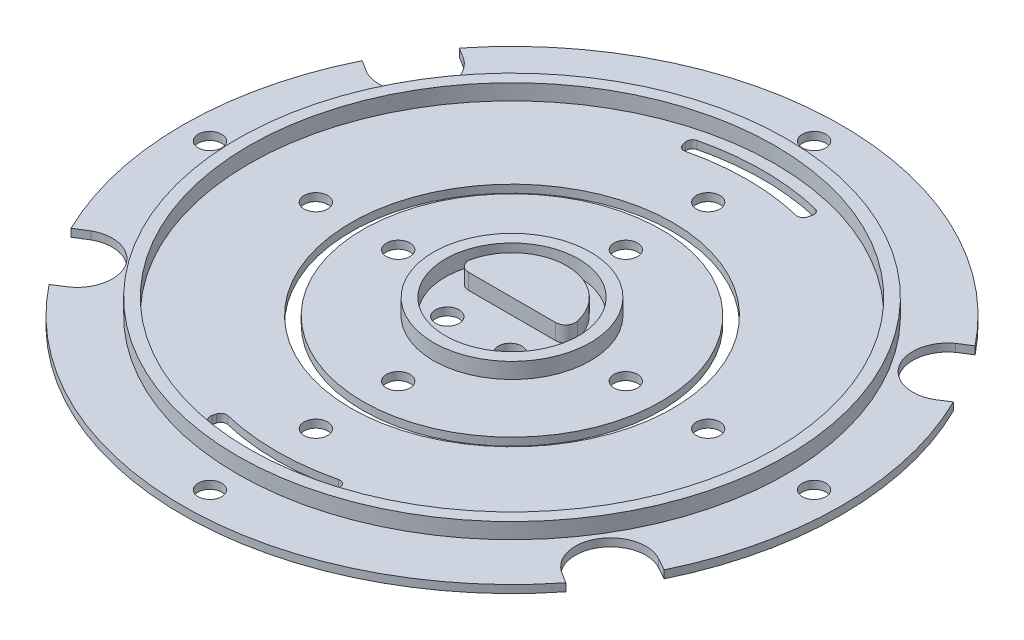
from build123d import *

# Parameters (mm, degrees)
SKETCH_1_R          = 35
EXTRUDE_1_DEPTH     = 2
SKETCH_2_R          = 33.5
SKETCH_2_R_2        = 10
SKETCH_2_R_3        = 8.490267481
CUT_EXTRUDE_1_DEPTH = 2
SKETCH_5_R          = 42
EXTRUDE_3_DEPTH     = 2
CUT_EXTRUDE_3_DEPTH = 2
SKETCH_7_R          = 1.5
CUT_EXTRUDE_4_DEPTH = 2
CUT_EXTRUDE_5_DEPTH = 2
SKETCH_10_R         = 20.5
SKETCH_10_R_2       = 19
CUT_EXTRUDE_6_DEPTH = 2
SKETCH_11_R         = 1.5
CUT_EXTRUDE_7_DEPTH = 2
SKETCH_12_R         = 1.5
CUT_EXTRUDE_8_DEPTH = 2
SKETCH_13_R         = 42
CUT_EXTRUDE_9_DEPTH = 1
SKETCH_15_R         = 2
EXTRUDE_5_DEPTH     = 4


with BuildPart() as part:
    # Эскиз1 → Бобышка-Вытянуть1 (new body)
    with BuildSketch(Plane(origin=(0, 0, 0), x_dir=(1, 0, 0), z_dir=(0, 1, 0))):
        with Locations(Location((0, 0, 0), (0, 0, 270))):
            Circle(SKETCH_1_R)
    extrude(amount=EXTRUDE_1_DEPTH)

    # Эскиз2 → Вырез-Вытянуть1 (cut)
    # profile 1 of 2: a face of its own
    with BuildSketch(Plane(origin=(0, 2, 0), x_dir=(1, 0, 0), z_dir=(0, 1, 0))):
        with Locations(Location((0, 0, 0), (0, 0, 270))):
            Circle(SKETCH_2_R)
        with Locations(Location((0, 0, 0), (0, 0, 270))):
            Circle(SKETCH_2_R_2, mode=Mode.SUBTRACT)
    # profile 2 of 2: a face of its own
    with BuildSketch(Plane(origin=(0, 2, 0), x_dir=(1, 0, 0), z_dir=(0, 1, 0))):
        with Locations(Location((0, 0, 0), (0, 0, 270))):
            Circle(SKETCH_2_R_3)
        with BuildLine():
            Line((5.565646409, 0), (-5.565646409, 0))
            ThreePointArc((-5.565646409, 0), (-6.552289655, 0.474742908), (-6.796984316, 1.5419684))
            ThreePointArc((-6.796984316, 1.5419684), (0, 6.969696), (6.796984316, 1.5419684))
            ThreePointArc((6.796984316, 1.5419684), (6.552289655, 0.474742908), (5.565646409, 0))
        make_face(mode=Mode.SUBTRACT)
    extrude(amount=-CUT_EXTRUDE_1_DEPTH, mode=Mode.SUBTRACT)


with BuildPart() as cut_extrude_1_piece_1:
    # of the separate pieces the step leaves, piece 1, a body of its own (cut_extrude_1_pieces)
    add(part.part.solids().sort_by_distance((0, 0, 35))[0])


with BuildPart() as cut_extrude_1_piece_2:
    # of the separate pieces the step leaves, piece 2, a body of its own (cut_extrude_1_pieces)
    add(part.part.solids().sort_by_distance((0, 0, 10))[0])


with BuildPart() as cut_extrude_1_piece_3:
    # of the separate pieces the step leaves, piece 3, a body of its own (cut_extrude_1_pieces)
    add(part.part.solids().sort_by_distance((6.796984316, 0, -1.5419684))[0])

    # Эскиз5 → Бобышка-Вытянуть3 (add)
    with BuildSketch(Plane.XZ):
        with Locations(Location((0, 0, 0), (0, 0, 270))):
            Circle(SKETCH_5_R)
    extrude(amount=EXTRUDE_3_DEPTH)

    # Эскиз6 → Вырез-Вытянуть3 (cut)
    with BuildSketch(Plane.XZ.offset(2)):
        with BuildLine():
            Line((-36.133737418, -17.602335874), (-37.66875903, -18.575914329))
            ThreePointArc((-37.66875903, -18.575914329), (-35.467791488, -22.495238762), (-32.860565687, -26.156896275))
            Line((-32.860565687, -26.156896275), (-31.325544076, -25.183317819))
            ThreePointArc((-31.325544076, -25.183317819), (-30.199879483, -19.154096464), (-36.133737418, -17.602335874))
        make_face()
        with BuildLine():
            Line((31.325544076, -25.183317819), (32.860565687, -26.156896275))
            ThreePointArc((32.860565687, -26.156896275), (35.467791488, -22.495238762), (37.66875903, -18.575914329))
            Line((37.66875903, -18.575914329), (36.133737418, -17.602335874))
            ThreePointArc((36.133737418, -17.602335874), (30.199879483, -19.154096464), (31.325544076, -25.183317819))
        make_face()
        with BuildLine():
            Line((31.390742359, 25.102001956), (32.928406926, 26.071440645))
            ThreePointArc((32.928406926, 26.071440645), (35.555588694, 22.356209711), (37.765435228, 18.378571816))
            Line((37.765435228, 18.378571816), (36.18307095, 17.500702403))
            ThreePointArc((36.18307095, 17.500702403), (30.193381094, 19.035771779), (31.390742359, 25.102001956))
        make_face()
        with BuildLine():
            Line((-31.390742359, 25.102001956), (-32.928406926, 26.071440645))
            ThreePointArc((-32.928406926, 26.071440645), (-35.528443123, 22.399324303), (-37.720735518, 18.470141092))
            Line((-37.720735518, 18.470141092), (-36.18307095, 17.500702403))
            ThreePointArc((-36.18307095, 17.500702403), (-30.193381094, 19.035771779), (-31.390742359, 25.102001956))
        make_face()
    extrude(amount=-CUT_EXTRUDE_3_DEPTH, mode=Mode.SUBTRACT)

    # Эскиз7 → Вырез-Вытянуть4 (cut)
    with BuildSketch(Plane(origin=(0, 0, 0), x_dir=(1, 0, 0), z_dir=(0, 1, 0))):
        with Locations(Location((0, 25, 0), (0, 0, 270))):
            Circle(SKETCH_7_R)
        with Locations(Location((-25, 0, 0), (0, 0, 270))):
            Circle(SKETCH_7_R)
        with Locations(Location((25, 0, 0), (0, 0, 270))):
            Circle(SKETCH_7_R)
        with Locations(Location((0, -25, 0), (0, 0, 270))):
            Circle(SKETCH_7_R)
        with Locations(Location((4, -4.24513374, 0), (0, 0, 270))):
            Circle(SKETCH_7_R)
        with Locations(Location((-4, -4.24513374, 0), (0, 0, 270))):
            Circle(SKETCH_7_R)
    extrude(amount=-CUT_EXTRUDE_4_DEPTH, mode=Mode.SUBTRACT)

    # Эскиз9 → Вырез-Вытянуть5 (cut)
    with BuildSketch(Plane(origin=(0, 0, 0), x_dir=(1, 0, 0), z_dir=(0, 1, 0))):
        with BuildLine():
            Line((-7.956318037, -29.693383157), (-8.085765453, -30.176487487))
            ThreePointArc((-8.085765453, -30.176487487), (-8.006293038, -30.753369556), (-7.537992789, -31.099496213))
            ThreePointArc((-7.537992789, -31.099496213), (0, -32), (7.537992789, -31.099496213))
            ThreePointArc((7.537992789, -31.099496213), (8.006293038, -30.753369556), (8.085765453, -30.176487487))
            Line((8.085765453, -30.176487487), (7.956318037, -29.693383157))
            ThreePointArc((7.956318037, -29.693383157), (7.614767331, -29.242600206), (7.055486505, -29.158534088))
            ThreePointArc((7.055486505, -29.158534088), (0, -30), (-7.055486505, -29.158534088))
            ThreePointArc((-7.055486505, -29.158534088), (-7.614767331, -29.242600206), (-7.956318037, -29.693383157))
        make_face()
        with BuildLine():
            Line((7.956318037, 29.693383157), (8.085765453, 30.176487487))
            ThreePointArc((8.085765453, 30.176487487), (8.006293038, 30.753369556), (7.537992789, 31.099496213))
            ThreePointArc((7.537992789, 31.099496213), (0, 32), (-7.537992789, 31.099496213))
            ThreePointArc((-7.537992789, 31.099496213), (-8.006293038, 30.753369556), (-8.085765453, 30.176487487))
            Line((-8.085765453, 30.176487487), (-7.956318037, 29.693383157))
            ThreePointArc((-7.956318037, 29.693383157), (-7.614767331, 29.242600206), (-7.055486505, 29.158534088))
            ThreePointArc((-7.055486505, 29.158534088), (0, 30), (7.055486505, 29.158534088))
            ThreePointArc((7.055486505, 29.158534088), (7.614767331, 29.242600206), (7.956318037, 29.693383157))
        make_face()
    extrude(amount=-CUT_EXTRUDE_5_DEPTH, mode=Mode.SUBTRACT)

    # Эскиз10 → Вырез-Вытянуть6 (cut)
    with BuildSketch(Plane(origin=(0, 0, 0), x_dir=(1, 0, 0), z_dir=(0, 1, 0))):
        with Locations(Location((0, 0, 0), (0, 0, 270))):
            Circle(SKETCH_10_R)
        with Locations(Location((0, 0, 0), (0, 0, 270))):
            Circle(SKETCH_10_R_2, mode=Mode.SUBTRACT)
    extrude(amount=-CUT_EXTRUDE_6_DEPTH, mode=Mode.SUBTRACT)


with BuildPart() as cut_extrude_6_piece_1:
    # of the separate pieces the step leaves, piece 1, a body of its own (cut_extrude_6_pieces)
    add(cut_extrude_1_piece_3.part.solids().sort_by_distance((-32.860565687, 0, -26.156896275))[0])

    # Эскиз12 → Вырез-Вытянуть8 (cut)
    with BuildSketch(Plane(origin=(0, 0, 0), x_dir=(1, 0, 0), z_dir=(0, 1, 0))):
        with Locations(Location((0, -38.5, 0), (0, 0, 270))):
            Circle(SKETCH_12_R)
        with Locations(Location((-38.5, 0, 0), (0, 0, 270))):
            Circle(SKETCH_12_R)
        with Locations(Location((0, 38.5, 0), (0, 0, 270))):
            Circle(SKETCH_12_R)
        with Locations(Location((38.5, 0, 0), (0, 0, 270))):
            Circle(SKETCH_12_R)
    extrude(amount=-CUT_EXTRUDE_8_DEPTH, mode=Mode.SUBTRACT)


with BuildPart() as cut_extrude_6_piece_2:
    # of the separate pieces the step leaves, piece 2, a body of its own (cut_extrude_6_pieces)
    add(cut_extrude_1_piece_3.part.solids().sort_by_distance((0, 0, 19))[0])

    # Эскиз11 → Вырез-Вытянуть7 (cut)
    with BuildSketch(Plane(origin=(0, 0, 0), x_dir=(1, 0, 0), z_dir=(0, 1, 0))):
        with Locations(Location((0, 14.5, 0), (0, 0, 270))):
            Circle(SKETCH_11_R)
        with Locations(Location((14.5, 0, 0), (0, 0, 270))):
            Circle(SKETCH_11_R)
        with Locations(Location((0, -14.5, 0), (0, 0, 270))):
            Circle(SKETCH_11_R)
        with Locations(Location((-14.5, 0, 0), (0, 0, 270))):
            Circle(SKETCH_11_R)
    extrude(amount=-CUT_EXTRUDE_7_DEPTH, mode=Mode.SUBTRACT)


with BuildPart() as cut_extrude_9_tool:
    # Эскиз13 → Вырез-Вытянуть9 (new body)
    with BuildSketch(Plane.XZ.offset(2)):
        Circle(SKETCH_13_R)
    extrude(amount=-CUT_EXTRUDE_9_DEPTH)


with BuildPart() as cut_extrude_6_piece_1_1:
    add(cut_extrude_6_piece_1.part)

    # Вырез-Вытянуть9: cut by cut_extrude_9_tool
    add(cut_extrude_9_tool.part, mode=Mode.SUBTRACT)

    # Эскиз15 → Бобышка-Вытянуть5 (add)
    with BuildSketch(Plane.XZ.offset(1)):
        with Locations(Location((21.999920011, 21.935618834, 0), (0, 0, 270))):
            Circle(SKETCH_15_R)
        with Locations(Location((21.999920011, -22.064217134, 0), (0, 0, 270))):
            Circle(SKETCH_15_R)
        with Locations(Location((-21.999915957, -22.064217134, 0), (0, 0, 270))):
            Circle(SKETCH_15_R)
        with Locations(Location((-21.999915957, 21.935779051, 0), (0, 0, 270))):
            Circle(SKETCH_15_R)
        with Locations(Location((-8.4963e-05, 4.185778691, 0), (0, 0, 270))):
            Circle(SKETCH_15_R)
    extrude(amount=EXTRUDE_5_DEPTH)


with BuildPart() as cut_extrude_6_piece_2_1:
    add(cut_extrude_6_piece_2.part)

    # Вырез-Вытянуть9: cut by cut_extrude_9_tool
    add(cut_extrude_9_tool.part, mode=Mode.SUBTRACT)


with BuildPart() as extrude_5_piece_1:
    # of the separate pieces the step leaves, piece 1, a body of its own (extrude_5_pieces)
    add(cut_extrude_6_piece_1_1.part.solids().sort_by_distance((-32.860565687, 0, -26.156896275))[0])


with BuildPart() as extrude_5_piece_2:
    # of the separate pieces the step leaves, piece 2, a body of its own (extrude_5_pieces)
    add(cut_extrude_6_piece_1_1.part.solids().sort_by_distance((-8.4963e-05, -1, 2.185778691))[0])


solid = Compound([cut_extrude_1_piece_1.part, cut_extrude_1_piece_2.part, cut_extrude_6_piece_2_1.part, extrude_5_piece_1.part, extrude_5_piece_2.part])
